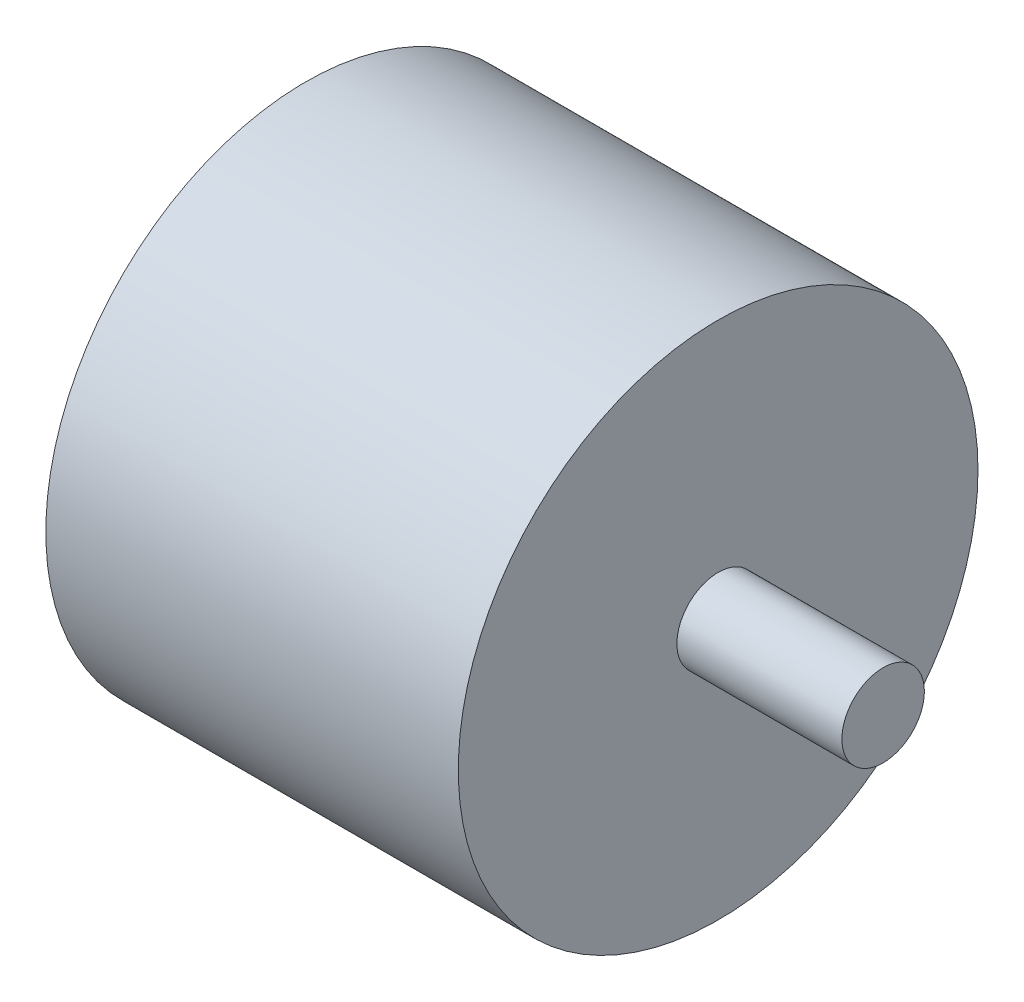
from build123d import *

# Parameters (mm, degrees)
SKETCH1_R           = 31.5
BOSS_EXTRUDE1_DEPTH = 25
SHELL1_T            = -5
SKETCH2_R           = 5
BOSS_EXTRUDE3_DEPTH = 20


with BuildPart() as part:
    # Sketch1 → Boss-Extrude1 (new, symmetric)
    with BuildSketch(Plane(origin=(0, 0, 0), x_dir=(0, 0, -1), z_dir=(1, 0, 0))):
        Circle(SKETCH1_R)
    extrude(amount=BOSS_EXTRUDE1_DEPTH, both=True)

    # Shell1
    shell1_openings = [part.faces().sort_by_distance(p)[0] for p in [
        (-25, 0, 0),
    ]]
    offset(amount=SHELL1_T, openings=shell1_openings, kind=Kind.INTERSECTION)

    # Sketch2 → Boss-Extrude3 (add)
    with BuildSketch(Plane(origin=(25, 0, 0), x_dir=(0, 0, -1), z_dir=(1, 0, 0))):
        Circle(SKETCH2_R)
    extrude(amount=BOSS_EXTRUDE3_DEPTH)


solid = part.part
